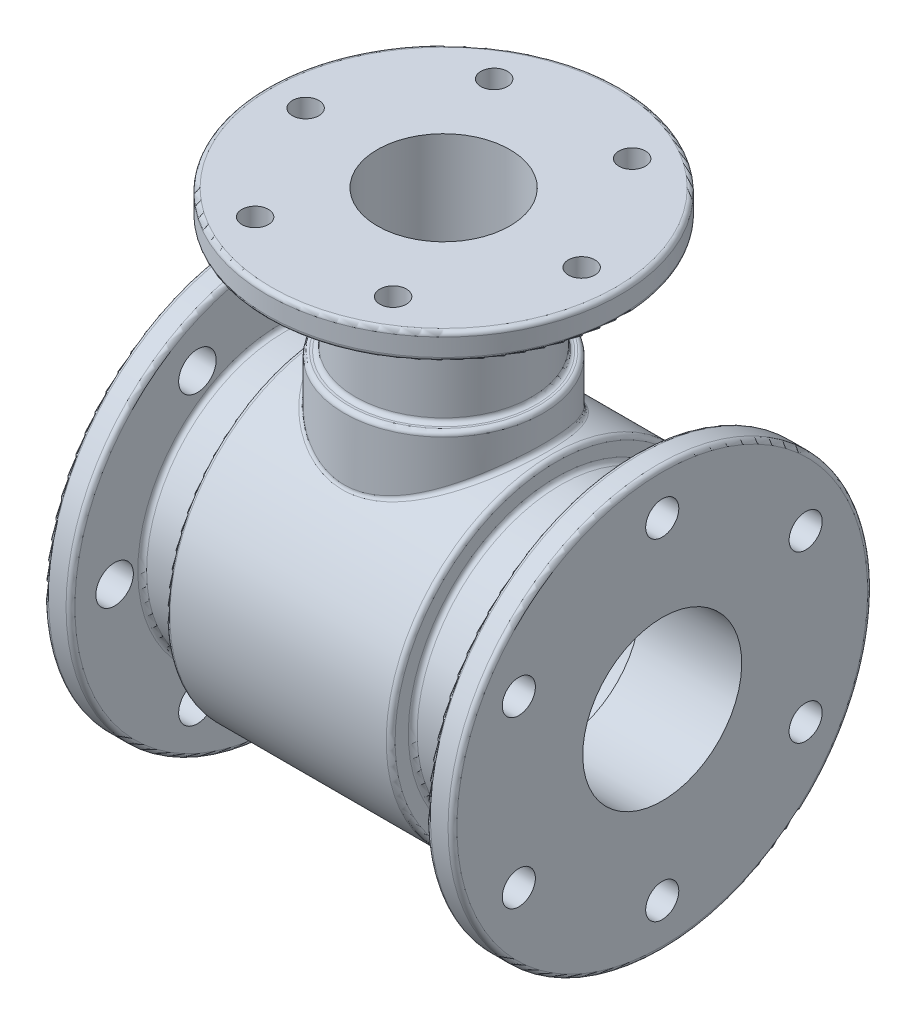
from build123d import *

# Parameters (mm, degrees)
BOSS_EXTRUDE1_REACH        = 220.463
BOSS_EXTRUDE1_END_RADIUS   = 75
SKETCH3_R                  = 45
F_6_0MM_DOWEL_HOLE1_REACH  = 287.177
F_6_0MM_DOWEL_HOLE1_BORE_R = 30
F_6_0MM_DOWEL_HOLE2_D      = 15
F_6_0MM_DOWEL_HOLE2_DEPTH  = 12
CIRPATTERN1_COUNT          = 6
F_6_0MM_DOWEL_HOLE3_D      = 17
F_6_0MM_DOWEL_HOLE3_DEPTH  = 12
CIRPATTERN2_COUNT          = 6
F_6_0MM_DOWEL_HOLE4_D      = 12
F_6_0MM_DOWEL_HOLE4_DEPTH  = 12
CIRPATTERN3_COUNT          = 6
FILLET1_R                  = 2


with BuildPart() as part:
    # Sketch1 → Revolve1 (revolve)
    with BuildSketch(Plane.XY, mode=Mode.PRIVATE) as revolve1_sk:
        with BuildLine():
            Line((99, -36), (99, -95))
            Line((99, -95), (87, -95))
            Line((87, -95), (87, -50))
            Line((87, -50), (73, -50))
            Line((73, -50), (73, -65))
            Line((73, -65), (51, -65))
            Line((51, -65), (51, -75))
            Line((51, -75), (-51, -75))
            Line((-51, -75), (-51, -62.5))
            Line((-51, -62.5), (-74, -62.5))
            Line((-74, -62.5), (-74, -95))
            Line((-74, -95), (-86, -95))
            Line((-86, -95), (-86, -52.5))
            Line((-86, -52.5), (-81, -52.5))
            Line((-81, -52.5), (-81, -47.5))
            Line((-81, -47.5), (-36, -47.5))
            Line((-36, -47.5), (-36, -50.5))
            ThreePointArc((-36, -50.5), (-35.414213562, -51.914213562), (-34, -52.5))
            Line((-34, -52.5), (34, -52.5))
            ThreePointArc((34, -52.5), (35.414213562, -51.914213562), (36, -50.5))
            Line((36, -50.5), (36, -43.5))
            Line((36, -43.5), (51, -43.5))
            Line((51, -43.5), (53, -41.5))
            Line((53, -41.5), (53, -36))
            Line((53, -36), (99, -36))
        make_face()
    revolve(revolve1_sk.sketch.rotate(Axis((0, 0, 0), (-1, 0, 0)), 180), axis=Axis((0, 0, 0), (-1, 0, 0)))



with BuildPart() as body_2:
    # Sketch2 → Revolve2 (revolve)
    with BuildSketch(Plane.XY, mode=Mode.PRIVATE) as revolve2_sk:
        Polygon((0, 155), (80, 155), (80, 143), (40, 143), (40, 91), (45, 91), (45, 75), (0, 75), align=None)
    revolve(revolve2_sk.sketch.rotate(Axis((0, 0, 0), (0, -1, 0)), 90), axis=Axis((0, 0, 0), (0, -1, 0)))


with BuildPart() as part_1:
    add(part.part)

    add(body_2.part)  # Boss-Extrude1 merges body 2
    # Boss-Extrude1: up to this cylinder (the profile starts outside it)
    boss_extrude1_end = Plane(origin=(0, 0, 0), z_dir=(1, 0, 0)) * Cylinder(BOSS_EXTRUDE1_END_RADIUS, 591.926, mode=Mode.PRIVATE)
    # Sketch3 → Boss-Extrude1 (add, up to the surface)
    with BuildSketch(Plane.XZ.offset(-75), mode=Mode.PRIVATE) as boss_extrude1_sk1:
        with Locations(Location((0, 0, 0), (0, 0, 90))):
            Circle(SKETCH3_R)
    boss_extrude1_tool1 = extrude(boss_extrude1_sk1.sketch, amount=BOSS_EXTRUDE1_REACH, mode=Mode.PRIVATE) - boss_extrude1_end
    add(boss_extrude1_tool1.solids().sort_by_distance((0, 75, 0))[0])
    add(boss_extrude1_tool1.solids().sort_by_distance((0, 75, 0))[1])

    # Ø6.0mm Dowel Hole1 bore → Ø6.0mm Dowel Hole1 (cut, up to next)
    with BuildSketch(Plane(origin=(0, 155, 0), x_dir=(1, 0, 0), z_dir=(0, 1, 0)), mode=Mode.PRIVATE) as f_6_0mm_dowel_hole1_sk1:
        Circle(F_6_0MM_DOWEL_HOLE1_BORE_R)
    f_6_0mm_dowel_hole1_tool1 = extrude(f_6_0mm_dowel_hole1_sk1.sketch, amount=-F_6_0MM_DOWEL_HOLE1_REACH, mode=Mode.PRIVATE) & part_1.part
    add(f_6_0mm_dowel_hole1_tool1.solids().sort_by_distance((0, 155, 0))[0], mode=Mode.SUBTRACT)

    # Ø6.0mm Dowel Hole2
    with Locations(Plane(origin=(99, 0, 0), x_dir=(0, 0, -1), z_dir=(1, 0, 0))):
        with Locations((0, 75)):
            f_6_0mm_dowel_hole2 = Hole(F_6_0MM_DOWEL_HOLE2_D / 2, depth=F_6_0MM_DOWEL_HOLE2_DEPTH)

    # CirPattern1: Ø6.0mm Dowel Hole2 ×6 about axis
    cirpattern1_axis = Axis((0, 0, 0), (1, 0, 0))
    for i in range(1, CIRPATTERN1_COUNT):
        add(f_6_0mm_dowel_hole2.rotate(cirpattern1_axis, i * 360 / CIRPATTERN1_COUNT), mode=Mode.SUBTRACT)

    # Ø6.0mm Dowel Hole3
    with Locations(Plane.ZY.offset(86)):
        with Locations((75, 0)):
            f_6_0mm_dowel_hole3 = Hole(F_6_0MM_DOWEL_HOLE3_D / 2, depth=F_6_0MM_DOWEL_HOLE3_DEPTH)

    # CirPattern2: Ø6.0mm Dowel Hole3 ×6 about axis
    cirpattern2_axis = Axis((0, 0, 0), (1, 0, 0))
    for i in range(1, CIRPATTERN2_COUNT):
        add(f_6_0mm_dowel_hole3.rotate(cirpattern2_axis, i * 360 / CIRPATTERN2_COUNT), mode=Mode.SUBTRACT)

    # Ø6.0mm Dowel Hole4
    with Locations(Plane(origin=(0, 155, 0), x_dir=(1, 0, 0), z_dir=(0, 1, 0))):
        with Locations((62.5, 0)):
            f_6_0mm_dowel_hole4 = Hole(F_6_0MM_DOWEL_HOLE4_D / 2, depth=F_6_0MM_DOWEL_HOLE4_DEPTH)

    # CirPattern3: Ø6.0mm Dowel Hole4 ×6 about axis
    cirpattern3_axis = Axis((0, 0, 0), (0, 1, 0))
    for i in range(1, CIRPATTERN3_COUNT):
        add(f_6_0mm_dowel_hole4.rotate(cirpattern3_axis, i * 360 / CIRPATTERN3_COUNT), mode=Mode.SUBTRACT)

    # Fillet1
    fillet1_edges = [part_1.edges().sort_by_distance(p)[0] for p in [
        (-86, -95, 0),
        (-74, -95, 0),
        (-74, -62.5, 0),
        (-51, -62.5, 0),
        (-51, -75, 0),
        (51, -75, 0),
        (51, -65, 0),
        (73, -65, 0),
        (73, -50, 0),
        (87, -50, 0),
        (87, -95, 0),
        (99, -95, 0),
        (0, 60, -45),
        (0, 155, -80),
        (0, 143, -80),
        (0, 143, -40),
        (0, 91, -40),
        (0, 91, -45),
    ]]
    fillet(fillet1_edges, radius=FILLET1_R)


solid = part_1.part
